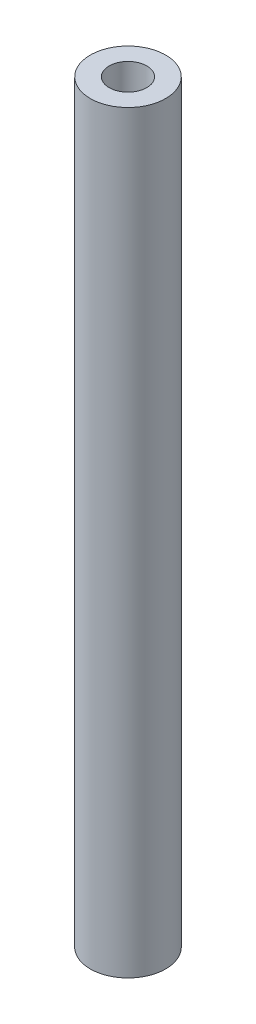
from build123d import *

# Parameters (mm, degrees)
SKETCH_1_R      = 6
SKETCH_1_R_2    = 3
EXTRUDE_1_DEPTH = 120


with BuildPart() as part:
    # 草图1 → 凸台-拉伸1 (new body)
    with BuildSketch(Plane(origin=(0, 0, 0), x_dir=(1, 0, 0), z_dir=(0, 1, 0))):
        with Locations(Location((0, 0, 0), (0, 0, 270))):
            Circle(SKETCH_1_R)
        with Locations(Location((0, 0, 0), (0, 0, 270))):
            Circle(SKETCH_1_R_2, mode=Mode.SUBTRACT)
    extrude(amount=EXTRUDE_1_DEPTH)


solid = part.part
